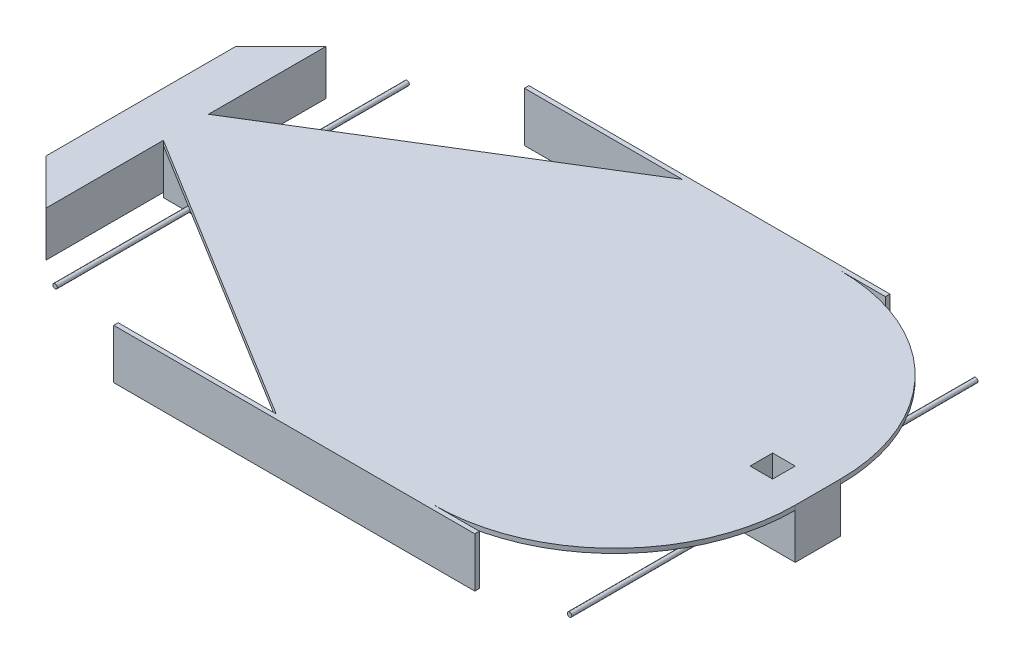
from build123d import *

# Parameters (mm, degrees)
SKETCH1_W                = 1778
SKETCH1_H                = 127
BOSS_EXTRUDE1_DEPTH      = 127
SKETCH2_W                = 127
SKETCH2_H                = 127
BOSS_EXTRUDE2_DEPTH      = 508
SKETCH3_W                = 127
SKETCH3_H                = 127
BOSS_EXTRUDE3_DEPTH      = 508
BOSS_EXTRUDE4_DEPTH      = 431.8
BOSS_EXTRUDE4_DEPTH_BACK = 558.8
SKETCH4_R                = 6.35
BOSS_EXTRUDE5_DEPTH      = 508
BOSS_EXTRUDE5_DEPTH_BACK = 635
SKETCH6_R                = 6.35
BOSS_EXTRUDE7_DEPTH      = 12.7
BOSS_EXTRUDE8_DEPTH      = 12.7
SKETCH11_W               = 1016
SKETCH11_H               = 139.7
BOSS_EXTRUDE9_DEPTH      = 12.7
SKETCH12_W               = 1016
SKETCH12_H               = 139.7
BOSS_EXTRUDE10_DEPTH     = 12.7
SKETCH13_W               = 127
SKETCH13_H               = 127
BOSS_EXTRUDE11_DEPTH     = 127
SKETCH15_W               = 63.5
SKETCH15_H               = 63.5
CUT_EXTRUDE1_DEPTH       = 63.5


with BuildPart() as part:
    # Sketch1 → Boss-Extrude1 (new body)
    with BuildSketch(Plane.XY):
        Rectangle(SKETCH1_W, SKETCH1_H)
    extrude(amount=BOSS_EXTRUDE1_DEPTH)

    # Sketch2 → Boss-Extrude2 (add)
    with BuildSketch(Plane.XY.offset(127)):
        Rectangle(SKETCH2_W, SKETCH2_H)
    extrude(amount=BOSS_EXTRUDE2_DEPTH)

    # Sketch3 → Boss-Extrude3 (add)
    with BuildSketch(Plane(origin=(0, 0, 0), x_dir=(-1, 0, 0), z_dir=(0, 0, -1))):
        Rectangle(SKETCH3_W, SKETCH3_H)
    extrude(amount=BOSS_EXTRUDE3_DEPTH)

    # Sketch4 → Boss-Extrude4 (add, two sides: drawn at the far end of the back side and taken through both)
    with BuildSketch(Plane.XY.offset(127).offset(-BOSS_EXTRUDE4_DEPTH_BACK)):
        with Locations((-762, 0)):
            Circle(SKETCH4_R)
    extrude(amount=BOSS_EXTRUDE4_DEPTH + BOSS_EXTRUDE4_DEPTH_BACK)

    # Sketch6 → Boss-Extrude5 (add, two sides: drawn at the far end of the back side and taken through both)
    with BuildSketch(Plane.XY.offset(127).offset(-BOSS_EXTRUDE5_DEPTH_BACK)):
        with Locations((762, 0)):
            Circle(SKETCH6_R)
    extrude(amount=BOSS_EXTRUDE5_DEPTH + BOSS_EXTRUDE5_DEPTH_BACK)

    # Sketch9 → Boss-Extrude7 (add)
    with BuildSketch(Plane(origin=(0, 63.5, 0), x_dir=(1, 0, 0), z_dir=(0, 1, 0))):
        with BuildLine():
            Line((-63.5, 508), (-63.5, -635))
            Line((-63.5, -635), (381, -635))
            ThreePointArc((381, -635), (740.210244843, -486.210244843), (889, -127))
            Line((889, -127), (889, 0))
            ThreePointArc((889, 0), (740.210244843, 359.210244843), (381, 508))
            Line((381, 508), (-63.5, 508))
        make_face()
    extrude(amount=BOSS_EXTRUDE7_DEPTH)

    # Sketch10 → Boss-Extrude8 (add)
    with BuildSketch(Plane(origin=(0, 63.5, 0), x_dir=(1, 0, 0), z_dir=(0, 1, 0))):
        with BuildLine():
            Line((-63.5, -635), (-889, -127))
            Line((-889, -127), (-889, 0))
            Line((-889, 0), (-63.5, 508))
            Line((-63.5, 508), (381, 508))
            ThreePointArc((381, 508), (740.210244843, 359.210244843), (889, 0))
            Line((889, 0), (889, -127))
            ThreePointArc((889, -127), (740.210244843, -486.210244843), (381, -635))
            Line((381, -635), (-63.5, -635))
        make_face()
    extrude(amount=BOSS_EXTRUDE8_DEPTH)

    # Sketch11 → Boss-Extrude9 (add)
    with BuildSketch(Plane(origin=(0, 0, -508), x_dir=(-1, 0, 0), z_dir=(0, 0, -1))):
        with Locations((0, 6.35)):
            Rectangle(SKETCH11_W, SKETCH11_H)
    extrude(amount=BOSS_EXTRUDE9_DEPTH)

    # Sketch12 → Boss-Extrude10 (add)
    with BuildSketch(Plane.XY.offset(635)):
        with Locations((0, 6.35)):
            Rectangle(SKETCH12_W, SKETCH12_H)
    extrude(amount=BOSS_EXTRUDE10_DEPTH)

    # Sketch13 → Boss-Extrude11 (add)
    with BuildSketch(Plane(origin=(0, 76.2, 0), x_dir=(1, 0, 0), z_dir=(0, 1, 0))):
        Polygon((-889, 330.2), (-889, 0), (-1016, 0), (-1016, 203.2), align=None)
        Polygon((-1016, -330.2), (-889, -457.2), (-889, -127), (-1016, -127), align=None)
        with Locations((-952.5, -63.5)):
            Rectangle(SKETCH13_W, SKETCH13_H)
    extrude(amount=-BOSS_EXTRUDE11_DEPTH)

    # Sketch15 → Cut-Extrude1 (cut)
    with BuildSketch(Plane(origin=(0, 76.2, 0), x_dir=(1, 0, 0), z_dir=(0, 1, 0))):
        with Locations((762, -63.5)):
            Rectangle(SKETCH15_W, SKETCH15_H)
    extrude(amount=-CUT_EXTRUDE1_DEPTH, mode=Mode.SUBTRACT)


solid = part.part
